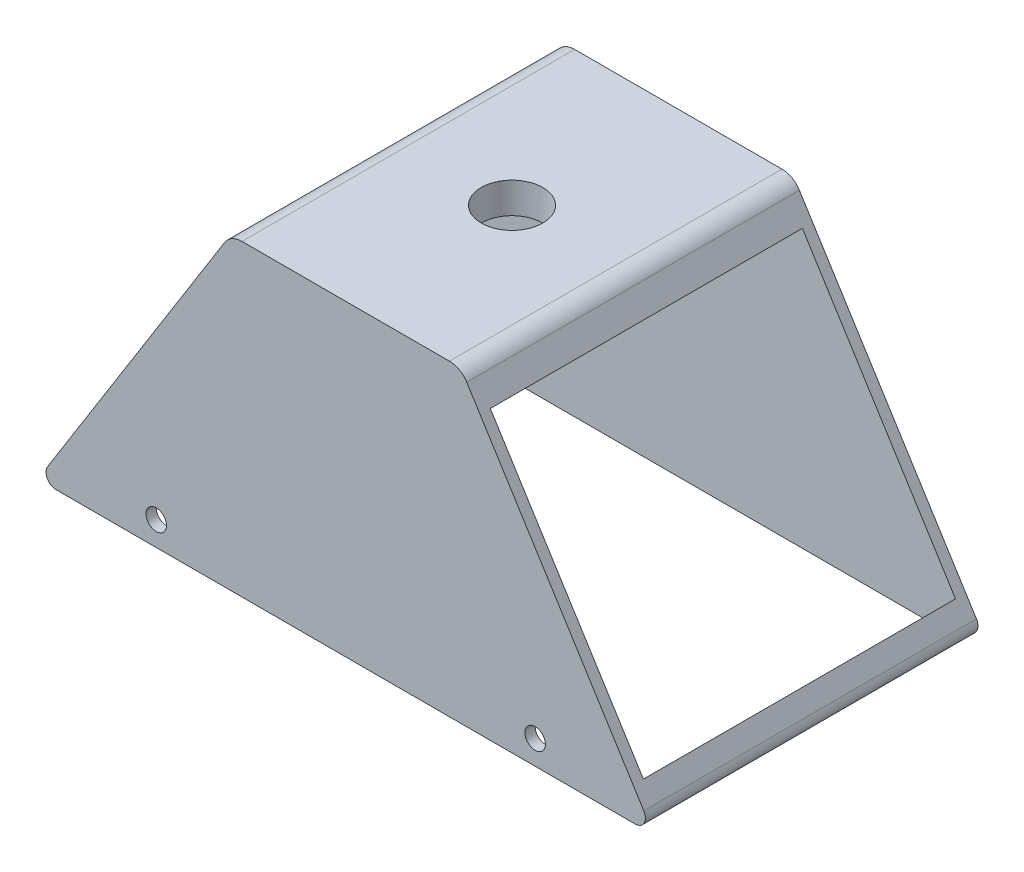
from build123d import *

# Parameters (mm, degrees)
BOSS_EXTRUDE1_DEPTH = 162
SKETCH2_R           = 15
CUT_EXTRUDE1_DEPTH  = 15
SKETCH4_W           = 280
SKETCH4_H           = 152
CUT_EXTRUDE3_DEPTH  = 135
FILLET2_R           = 10
FILLET3_R           = 5
SKETCH5_R           = 5
CUT_EXTRUDE4_DEPTH  = 135


with BuildPart() as part:
    # Sketch1 → Boss-Extrude1 (new body)
    with BuildSketch(Plane.XY):
        Polygon((-46.03724142, 83.913559712), (66.03724142, 83.913559712), (160, -66.086440288), (10, -66.086440288), (-140, -66.086440288), align=None)
    extrude(amount=BOSS_EXTRUDE1_DEPTH)

    # Sketch2 → Cut-Extrude1 (cut)
    with BuildSketch(Plane(origin=(0, 83.913559712, 0), x_dir=(1, 0, 0), z_dir=(0, 1, 0))):
        with Locations(Location((10, -81, 0), (0, 0, 180))):
            Circle(SKETCH2_R)
    extrude(amount=-CUT_EXTRUDE1_DEPTH, mode=Mode.SUBTRACT)

    # Sketch4 → Cut-Extrude3 (cut)
    with BuildSketch(Plane.XZ.offset(66.086440288)):
        with Locations((10, 81)):
            Rectangle(SKETCH4_W, SKETCH4_H)
    extrude(amount=-CUT_EXTRUDE3_DEPTH, mode=Mode.SUBTRACT)

    # Fillet2
    fillet2_edges = [part.edges().sort_by_distance(p)[0] for p in [
        (-46.03724142, 83.913559712, 81),
        (66.03724142, 83.913559712, 81),
    ]]
    fillet(fillet2_edges, radius=FILLET2_R)

    # Fillet3
    fillet3_edges = [part.edges().sort_by_distance(p)[0] for p in [
        (160, -66.086440288, 81),
        (-140, -66.086440288, 81),
    ]]
    fillet(fillet3_edges, radius=FILLET3_R)

    # Sketch5 → Cut-Extrude4 (cut)
    with BuildSketch(Plane.XY.offset(162)):
        with Locations((102.275314, -54.350620288)):
            Circle(SKETCH5_R)
        with Locations((-82.275314, -54.350620288)):
            Circle(SKETCH5_R)
    extrude(amount=-CUT_EXTRUDE4_DEPTH, mode=Mode.SUBTRACT)


solid = part.part
